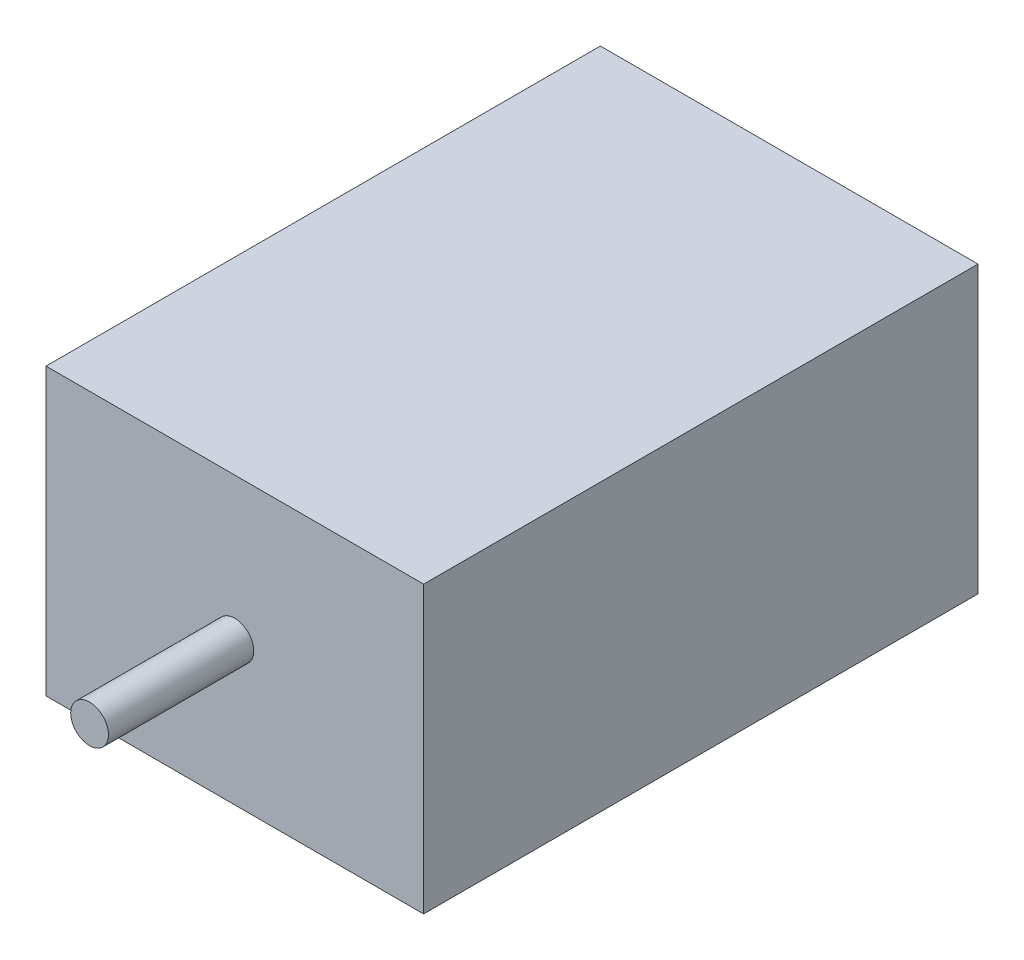
from build123d import *

# Parameters (mm, degrees)
SKETCH1_W           = 19.812
SKETCH1_H           = 14.986
BOSS_EXTRUDE1_DEPTH = 29.083
SKETCH2_R           = 0.9906
BOSS_EXTRUDE2_DEPTH = 7.62


with BuildPart() as part:
    # Sketch1 → Boss-Extrude1 (new body)
    with BuildSketch(Plane.XY):
        with Locations((9.906, 7.493)):
            Rectangle(SKETCH1_W, SKETCH1_H)
    extrude(amount=BOSS_EXTRUDE1_DEPTH)

    # Sketch2 → Boss-Extrude2 (add)
    with BuildSketch(Plane.XY.offset(29.083)):
        with Locations(Location((9.906, 7.493, 0), (0, 0, 180))):
            Circle(SKETCH2_R)
    extrude(amount=BOSS_EXTRUDE2_DEPTH)


solid = part.part
